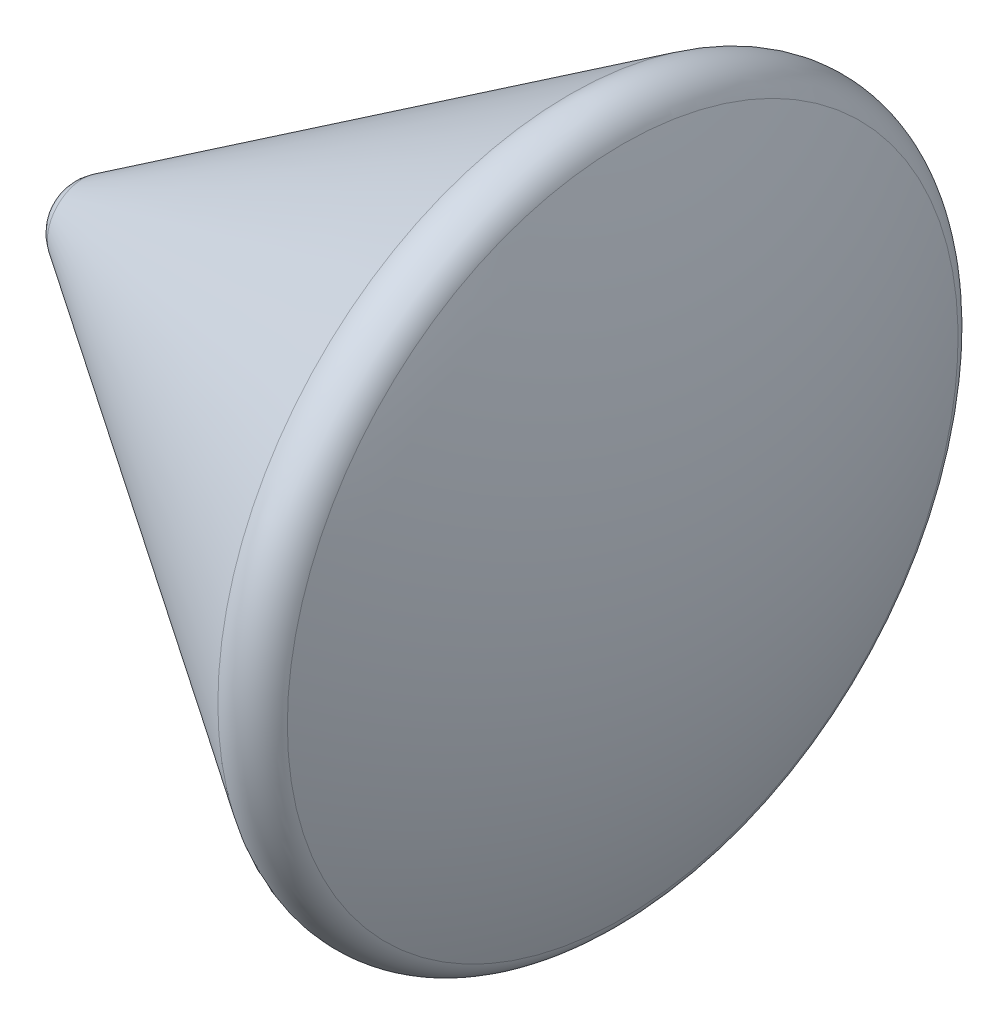
from build123d import *


with BuildPart() as part:
    # Schizzo1 → Rivoluzione1 (revolve)
    with BuildSketch(Plane.XY):
        with BuildLine():
            Line((105.188382912, 193.732901195), (2738.344598875, 1903.724541917))
            ThreePointArc((2738.344598875, 1903.724541917), (2902.809312677, 1926.654814934), (3025.846716467, 1815.136938452))
            ThreePointArc((3025.846716467, 1815.136938452), (3298.806302263, 925.750914907), (3391, 0))
            Line((3391, 0), (0, 0))
            ThreePointArc((0, 0), (27.993246975, 110.22367362), (105.188382912, 193.732901195))
        make_face()
    revolve(axis=Axis((0, 0, 0), (1, 0, 0)))


solid = part.part
